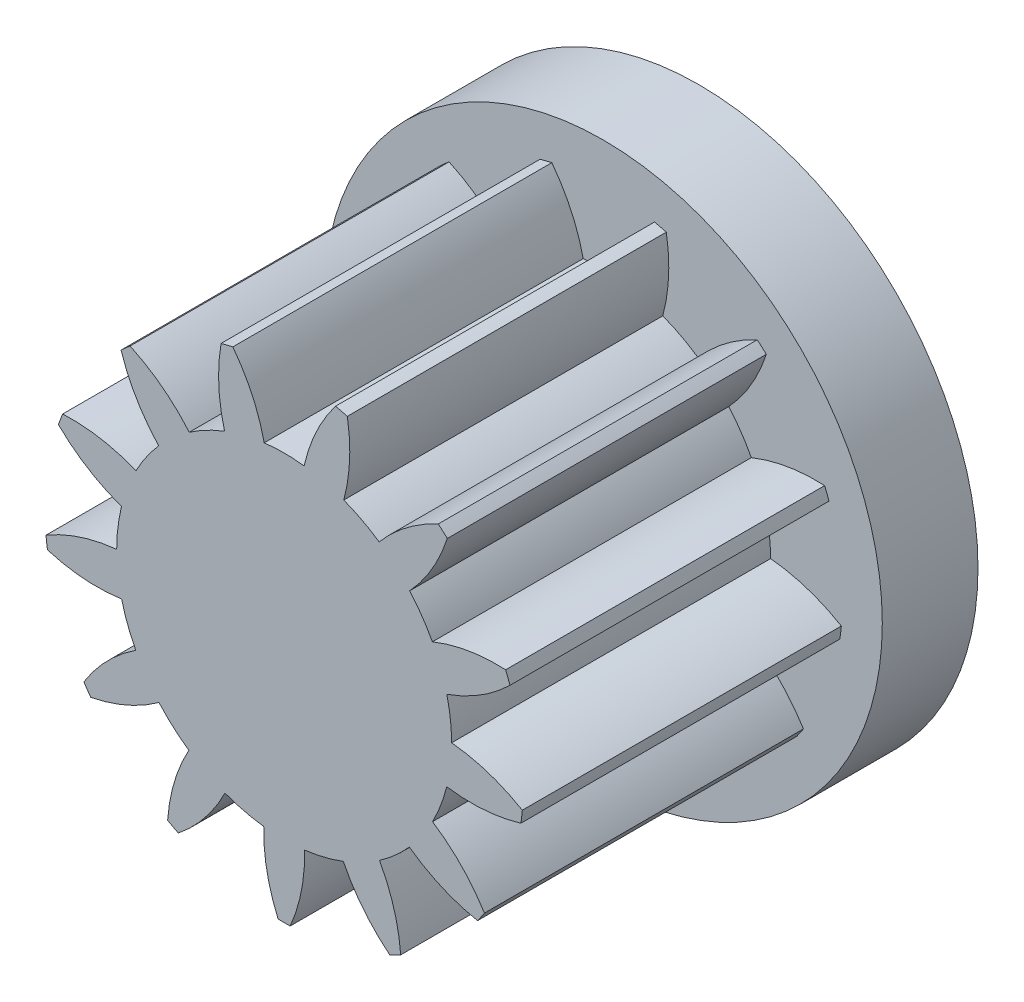
from build123d import *

# Parameters (mm, degrees)
SKETCH1_R           = 8.75
BOSS_EXTRUDE1_DEPTH = 3
BOSS_EXTRUDE2_DEPTH = 10


with BuildPart() as part:
    # Sketch1 → Boss-Extrude1 (new body)
    with BuildSketch(Plane.XY):
        Circle(SKETCH1_R)
    extrude(amount=BOSS_EXTRUDE1_DEPTH)

    # Sketch2 → Boss-Extrude2 (add)
    with BuildSketch(Plane.XY.offset(3)):
        with BuildLine():
            ThreePointArc((4.829991895, 5.737697996), (3.826186326, 5.132311911), (2.976672459, 4.324571779))
            ThreePointArc((2.976672459, 4.324571779), (2.440108702, 4.648480345), (1.868768811, 4.906139331))
            ThreePointArc((1.868768811, 4.906139331), (2.051102492, 6.064099762), (1.979255999, 7.234123699))
            ThreePointArc((1.979255999, 7.234123699), (1.795356309, 7.281943128), (1.610304214, 7.325088418))
            ThreePointArc((1.610304214, 7.325088418), (1.002815466, 6.322553954), (0.62598385, 5.212546807))
            ThreePointArc((0.62598385, 5.212546807), (0.000352422, 5.249999988), (-0.625284028, 5.212630803))
            ThreePointArc((-0.625284028, 5.212630803), (-1.001966616, 6.322688531), (-1.609320762, 7.325304546))
            ThreePointArc((-1.609320762, 7.325304546), (-1.794378647, 7.2821841), (-1.978284756, 7.234389361))
            ThreePointArc((-1.978284756, 7.234389361), (-2.050288332, 6.06437508), (-1.868110115, 4.90639018))
            ThreePointArc((-1.868110115, 4.90639018), (-2.439484593, 4.648807903), (-2.976091832, 4.324971377))
            ThreePointArc((-2.976091832, 4.324971377), (-3.825497247, 5.132825554), (-4.82922153, 5.738346401))
            ThreePointArc((-4.82922153, 5.738346401), (-4.97304308, 5.614164455), (-5.113672529, 5.486378884))
            ThreePointArc((-5.113672529, 5.486378884), (-4.633695781, 4.41692096), (-3.934242565, 3.476238691))
            ThreePointArc((-3.934242565, 3.476238691), (-4.320465088, 2.982629951), (-4.645112863, 2.44651313))
            ThreePointArc((-4.645112863, 2.44651313), (-5.772652562, 2.7670941), (-6.942805845, 2.83680225))
            ThreePointArc((-6.942805845, 2.83680225), (-7.012443275, 2.66000739), (-7.077579552, 2.481505124))
            ThreePointArc((-7.077579552, 2.481505124), (-6.15557937, 1.757603477), (-5.099087457, 1.249722811))
            ThreePointArc((-5.099087457, 1.249722811), (-5.211679097, 0.633167423), (-5.249994516, 0.007588209))
            ThreePointArc((-5.249994516, 0.007588209), (-6.397362742, -0.232545265), (-7.46587701, -0.71461911))
            ThreePointArc((-7.46587701, -0.71461911), (-7.445377224, -0.90352531), (-7.420098394, -1.091851556))
            ThreePointArc((-7.420098394, -1.091851556), (-6.267293907, -1.304359781), (-5.095792863, -1.263089504))
            ThreePointArc((-5.095792863, -1.263089504), (-4.908960234, -1.861346132), (-4.652165695, -2.43307508))
            ThreePointArc((-4.652165695, -2.43307508), (-5.556514215, -3.178911313), (-6.278605726, -4.102329843))
            ThreePointArc((-6.278605726, -4.102329843), (-6.172664978, -4.260071251), (-6.062762116, -4.415078202))
            ThreePointArc((-6.062762116, -4.415078202), (-4.94324694, -4.067509932), (-3.925113535, -3.486543236))
            ThreePointArc((-3.925113535, -3.486543236), (-3.48165774, -3.92944772), (-2.988581778, -4.316350189))
            ThreePointArc((-2.988581778, -4.316350189), (-3.442735244, -5.397027088), (-3.652981535, -6.550246247))
            ThreePointArc((-3.652981535, -6.550246247), (-3.485869574, -6.640686208), (-3.316520101, -6.726863639))
            ThreePointArc((-3.316520101, -6.726863639), (-2.486761671, -5.898842577), (-1.855237999, -4.91127193))
            ThreePointArc((-1.855237999, -4.91127193), (-1.256749416, -5.09736019), (-0.640349792, -5.210801488))
            ThreePointArc((-0.640349792, -5.210801488), (-0.540267119, -6.378748999), (-0.190503298, -7.497580176))
            ThreePointArc((-0.190503298, -7.497580176), (-0.00050346, -7.499999983), (0.189496701, -7.497605685))
            ThreePointArc((0.189496701, -7.497605685), (0.539410728, -6.378821476), (0.639650205, -5.210887412))
            ThreePointArc((0.639650205, -5.210887412), (1.256065053, -5.09752887), (1.854578614, -4.911520962))
            ThreePointArc((1.854578614, -4.911520962), (2.485969693, -5.899176387), (3.315616949, -6.727308842))
            ThreePointArc((3.315616949, -6.727308842), (3.48497799, -6.641154147), (3.652102092, -6.550736623))
            ThreePointArc((3.652102092, -6.550736623), (3.44201063, -5.397489248), (2.988002255, -4.316751385))
            ThreePointArc((2.988002255, -4.316751385), (3.481130156, -3.929915118), (3.92464541, -3.487070175))
            ThreePointArc((3.92464541, -3.487070175), (4.942700807, -4.068173557), (6.06216931, -4.415892125))
            ThreePointArc((6.06216931, -4.415892125), (6.172092982, -4.260899931), (6.278054907, -4.103172747))
            ThreePointArc((6.278054907, -4.103172747), (5.556087377, -3.17965728), (4.651838998, -2.433699639))
            ThreePointArc((4.651838998, -2.433699639), (4.908710292, -1.862005173), (5.09562324, -1.263773634))
            ThreePointArc((5.09562324, -1.263773634), (6.267118732, -1.305201192), (7.41995174, -1.092847739))
            ThreePointArc((7.41995174, -1.092847739), (7.445255854, -0.904524889), (7.465781001, -0.715621443))
            ThreePointArc((7.465781001, -0.715621443), (6.397331464, -0.233404148), (5.249995488, 0.006883365))
            ThreePointArc((5.249995488, 0.006883365), (5.211764057, 0.632467717), (5.099255194, 1.249038216))
            ThreePointArc((5.099255194, 1.249038216), (6.155815283, 1.756777037), (7.077912646, 2.480554893))
            ThreePointArc((7.077912646, 2.480554893), (7.012800334, 2.659065903), (6.94318664, 2.83587011))
            ThreePointArc((6.94318664, 2.83587011), (5.773024009, 2.766319061), (4.64544128, 2.445889473))
            ThreePointArc((4.64544128, 2.445889473), (4.320865485, 2.982049876), (3.934709236, 3.475710464))
            ThreePointArc((3.934709236, 3.475710464), (4.634288738, 4.416298818), (5.114409063, 5.485692293))
            ThreePointArc((5.114409063, 5.485692293), (4.973796771, 5.613496743), (4.829991895, 5.737697996))
        make_face()
    extrude(amount=BOSS_EXTRUDE2_DEPTH)


solid = part.part
